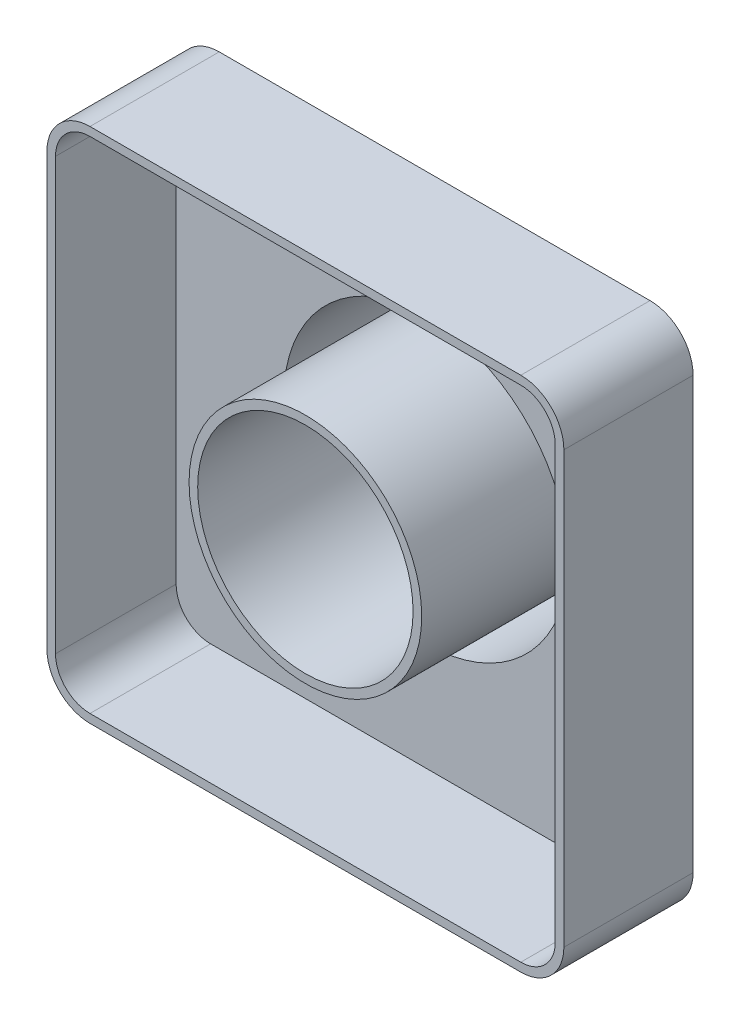
from build123d import *

# Parameters (mm, degrees)
SKETCH1_W               = 120
SKETCH1_H               = 120
BOSS_EXTRUDE3_DEPTH     = 30
SKETCH5_R               = 35
BOSS_EXTRUDE5_DEPTH     = 25
CUT_EXTRUDE3_DEPTH      = 75
CUT_EXTRUDE3_DEPTH_BACK = 67
SKETCH7_R               = 25
FILLET3_R               = 10
SHELL1_T                = -2


with BuildPart() as part:
    # Sketch1 → Boss-Extrude3 (new body)
    with BuildSketch(Plane.XY):
        with Locations((60, 60)):
            Rectangle(SKETCH1_W, SKETCH1_H)
    extrude(amount=BOSS_EXTRUDE3_DEPTH)

    # Sketch5 → Boss-Extrude5 (add)
    with BuildSketch(Plane.XY):
        with Locations((60, 60)):
            Circle(SKETCH5_R)
    extrude(amount=-BOSS_EXTRUDE5_DEPTH)

    # Sketch7 → Cut-Extrude3 (cut, two sides: drawn at the far end of the back side and taken through both)
    with BuildSketch(Plane.XY.offset(-CUT_EXTRUDE3_DEPTH_BACK)):
        with Locations((60, 60)):
            Circle(SKETCH7_R)
    extrude(amount=CUT_EXTRUDE3_DEPTH + CUT_EXTRUDE3_DEPTH_BACK, mode=Mode.SUBTRACT)

    # Fillet3
    fillet3_edges = [part.edges().sort_by_distance(p)[0] for p in [
        (0, 120, 15),
        (120, 120, 15),
        (120, 0, 15),
        (0, 0, 15),
    ]]
    fillet(fillet3_edges, radius=FILLET3_R)

    # Shell1
    shell1_openings = [part.faces().sort_by_distance(p)[0] for p in [
        (60, 1.697056275, 30),
    ]]
    offset(amount=SHELL1_T, openings=shell1_openings, kind=Kind.INTERSECTION)


solid = part.part
